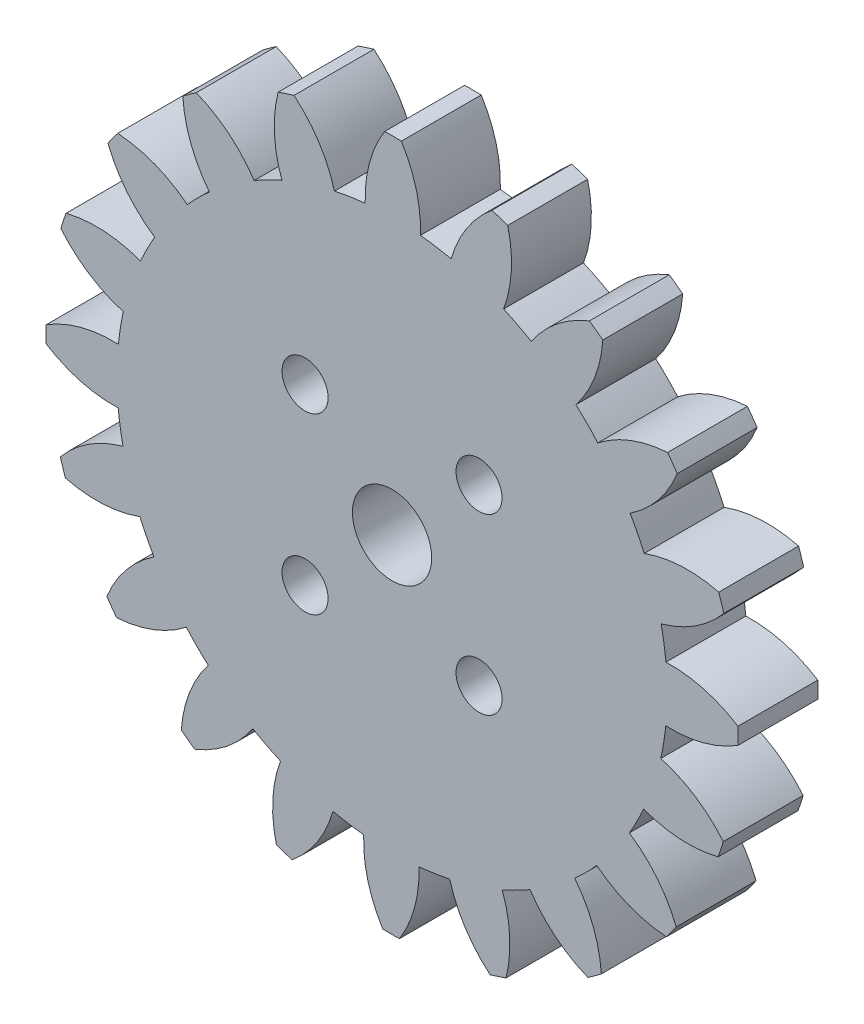
from build123d import *

# Parameters (mm, degrees)
BOSS_EXTRU_1_DEPTH      = 6.35
ENL_V_MAT_EXTRU_1_REACH = 41.406
ESQUISSE2_R             = 3.15
ESQUISSE2_R_2           = 1.83


with BuildPart() as part:
    # Esquisse1 → Boss.-Extru.1 (new body)
    with BuildSketch(Plane.XY):
        with BuildLine():
            ThreePointArc((4.580283008, -21.38908328), (5.809239787, -24.124430095), (7.79392735, -26.37242303))
            ThreePointArc((7.79392735, -26.37242303), (8.426297829, -26.177232568), (9.053788111, -25.96688123))
            ThreePointArc((9.053788111, -25.96688123), (9.354446156, -22.983248931), (8.756985681, -20.044627155))
            ThreePointArc((8.756985681, -20.044627155), (9.877166912, -19.517004119), (10.965698229, -18.926841743))
            ThreePointArc((10.965698229, -18.926841743), (12.979774233, -21.148542625), (15.561992292, -22.673208769))
            ThreePointArc((15.561992292, -22.673208769), (16.103095187, -22.292158383), (16.634871772, -21.898197212))
            ThreePointArc((16.634871772, -21.898197212), (15.998821478, -18.967685826), (14.522518732, -16.357515878))
            ThreePointArc((14.522518732, -16.357515878), (15.424829906, -15.509561514), (16.277714505, -14.611909064))
            ThreePointArc((16.277714505, -14.611909064), (18.879757941, -16.102488453), (21.806741003, -16.75458286))
            ThreePointArc((21.806741003, -16.75458286), (22.203609392, -16.224972418), (22.587618281, -15.685965077))
            ThreePointArc((22.587618281, -15.685965077), (21.077120684, -13.095433477), (18.866486465, -11.069216977))
            ThreePointArc((18.866486465, -11.069216977), (19.462603078, -9.983934966), (19.996354671, -8.86666092))
            ThreePointArc((19.996354671, -8.86666092), (22.9316594, -9.480210518), (25.916893968, -9.195901645))
            ThreePointArc((25.916893968, -9.195901645), (26.130679608, -8.569573106), (26.329331336, -7.93828139))
            ThreePointArc((26.329331336, -7.93828139), (24.092244465, -5.941308858), (21.363671052, -4.697385994))
            ThreePointArc((21.363671052, -4.697385994), (21.595241057, -3.481011302), (21.75761232, -2.253482226))
            ThreePointArc((21.75761232, -2.253482226), (24.738850262, -1.929943525), (27.490120777, -0.737061506))
            ThreePointArc((27.490120777, -0.737061506), (27.499896841, -0.075324271), (27.493745992, 0.586456589))
            ThreePointArc((27.493745992, 0.586456589), (24.749051496, 1.794392467), (21.769630667, 2.134257858))
            ThreePointArc((21.769630667, 2.134257858), (21.613986378, 3.362658002), (21.38908328, 4.580283008))
            ThreePointArc((21.38908328, 4.580283008), (24.124430095, 5.809239787), (26.37242303, 7.79392735))
            ThreePointArc((26.37242303, 7.79392735), (26.177232568, 8.426297829), (25.96688123, 9.053788111))
            ThreePointArc((25.96688123, 9.053788111), (22.983248931, 9.354446156), (20.044627155, 8.756985681))
            ThreePointArc((20.044627155, 8.756985681), (19.517004119, 9.877166912), (18.926841743, 10.965698229))
            ThreePointArc((18.926841743, 10.965698229), (21.148542625, 12.979774233), (22.673208769, 15.561992292))
            ThreePointArc((22.673208769, 15.561992292), (22.292158383, 16.103095187), (21.898197212, 16.634871772))
            ThreePointArc((21.898197212, 16.634871772), (18.967685826, 15.998821478), (16.357515878, 14.522518732))
            ThreePointArc((16.357515878, 14.522518732), (15.509561514, 15.424829906), (14.611909064, 16.277714505))
            ThreePointArc((14.611909064, 16.277714505), (16.102488453, 18.879757941), (16.75458286, 21.806741003))
            ThreePointArc((16.75458286, 21.806741003), (16.224972418, 22.203609392), (15.685965077, 22.587618281))
            ThreePointArc((15.685965077, 22.587618281), (13.095433477, 21.077120684), (11.069216977, 18.866486465))
            ThreePointArc((11.069216977, 18.866486465), (9.983934966, 19.462603078), (8.86666092, 19.996354671))
            ThreePointArc((8.86666092, 19.996354671), (9.480210518, 22.9316594), (9.195901645, 25.916893968))
            ThreePointArc((9.195901645, 25.916893968), (8.569573106, 26.130679608), (7.93828139, 26.329331336))
            ThreePointArc((7.93828139, 26.329331336), (5.941308858, 24.092244465), (4.697385994, 21.363671052))
            ThreePointArc((4.697385994, 21.363671052), (3.481011302, 21.595241057), (2.253482226, 21.75761232))
            ThreePointArc((2.253482226, 21.75761232), (1.929943525, 24.738850262), (0.737061506, 27.490120777))
            ThreePointArc((0.737061506, 27.490120777), (0.075324271, 27.499896841), (-0.586456589, 27.493745992))
            ThreePointArc((-0.586456589, 27.493745992), (-1.794392467, 24.749051496), (-2.134257858, 21.769630667))
            ThreePointArc((-2.134257858, 21.769630667), (-3.362658002, 21.613986378), (-4.580283008, 21.38908328))
            ThreePointArc((-4.580283008, 21.38908328), (-5.809239787, 24.124430095), (-7.79392735, 26.37242303))
            ThreePointArc((-7.79392735, 26.37242303), (-8.426297829, 26.177232568), (-9.053788111, 25.96688123))
            ThreePointArc((-9.053788111, 25.96688123), (-9.354446156, 22.983248931), (-8.756985681, 20.044627155))
            ThreePointArc((-8.756985681, 20.044627155), (-9.877166912, 19.517004119), (-10.965698229, 18.926841743))
            ThreePointArc((-10.965698229, 18.926841743), (-12.979774233, 21.148542625), (-15.561992292, 22.673208769))
            ThreePointArc((-15.561992292, 22.673208769), (-16.103095187, 22.292158383), (-16.634871772, 21.898197212))
            ThreePointArc((-16.634871772, 21.898197212), (-15.998821478, 18.967685826), (-14.522518732, 16.357515878))
            ThreePointArc((-14.522518732, 16.357515878), (-15.424829906, 15.509561514), (-16.277714505, 14.611909064))
            ThreePointArc((-16.277714505, 14.611909064), (-18.879757941, 16.102488453), (-21.806741003, 16.75458286))
            ThreePointArc((-21.806741003, 16.75458286), (-22.203609392, 16.224972418), (-22.587618281, 15.685965077))
            ThreePointArc((-22.587618281, 15.685965077), (-21.077120684, 13.095433477), (-18.866486465, 11.069216977))
            ThreePointArc((-18.866486465, 11.069216977), (-19.462603078, 9.983934966), (-19.996354671, 8.86666092))
            ThreePointArc((-19.996354671, 8.86666092), (-22.9316594, 9.480210518), (-25.916893968, 9.195901645))
            ThreePointArc((-25.916893968, 9.195901645), (-26.130679608, 8.569573106), (-26.329331336, 7.93828139))
            ThreePointArc((-26.329331336, 7.93828139), (-24.092244465, 5.941308858), (-21.363671052, 4.697385994))
            ThreePointArc((-21.363671052, 4.697385994), (-21.595241057, 3.481011302), (-21.75761232, 2.253482226))
            ThreePointArc((-21.75761232, 2.253482226), (-24.738850262, 1.929943525), (-27.490120777, 0.737061506))
            ThreePointArc((-27.490120777, 0.737061506), (-27.499896841, 0.075324271), (-27.493745992, -0.586456589))
            ThreePointArc((-27.493745992, -0.586456589), (-24.749051496, -1.794392467), (-21.769630667, -2.134257858))
            ThreePointArc((-21.769630667, -2.134257858), (-21.613986378, -3.362658002), (-21.38908328, -4.580283008))
            ThreePointArc((-21.38908328, -4.580283008), (-24.124430095, -5.809239787), (-26.37242303, -7.79392735))
            ThreePointArc((-26.37242303, -7.79392735), (-26.177232568, -8.426297829), (-25.96688123, -9.053788111))
            ThreePointArc((-25.96688123, -9.053788111), (-22.983248931, -9.354446156), (-20.044627155, -8.756985681))
            ThreePointArc((-20.044627155, -8.756985681), (-19.517004119, -9.877166912), (-18.926841743, -10.965698229))
            ThreePointArc((-18.926841743, -10.965698229), (-21.148542625, -12.979774233), (-22.673208769, -15.561992292))
            ThreePointArc((-22.673208769, -15.561992292), (-22.292158383, -16.103095187), (-21.898197212, -16.634871772))
            ThreePointArc((-21.898197212, -16.634871772), (-18.967685826, -15.998821478), (-16.357515878, -14.522518732))
            ThreePointArc((-16.357515878, -14.522518732), (-15.509561514, -15.424829906), (-14.611909064, -16.277714505))
            ThreePointArc((-14.611909064, -16.277714505), (-16.102488453, -18.879757941), (-16.75458286, -21.806741003))
            ThreePointArc((-16.75458286, -21.806741003), (-16.224972418, -22.203609392), (-15.685965077, -22.587618281))
            ThreePointArc((-15.685965077, -22.587618281), (-13.095433477, -21.077120684), (-11.069216977, -18.866486465))
            ThreePointArc((-11.069216977, -18.866486465), (-9.983934966, -19.462603078), (-8.86666092, -19.996354671))
            ThreePointArc((-8.86666092, -19.996354671), (-9.480210518, -22.9316594), (-9.195901645, -25.916893968))
            ThreePointArc((-9.195901645, -25.916893968), (-8.569573106, -26.130679608), (-7.93828139, -26.329331336))
            ThreePointArc((-7.93828139, -26.329331336), (-5.941308858, -24.092244465), (-4.697385994, -21.363671052))
            ThreePointArc((-4.697385994, -21.363671052), (-3.481011302, -21.595241057), (-2.253482226, -21.75761232))
            ThreePointArc((-2.253482226, -21.75761232), (-1.929943525, -24.738850262), (-0.737061506, -27.490120777))
            ThreePointArc((-0.737061506, -27.490120777), (-0.075324271, -27.499896841), (0.586456589, -27.493745992))
            ThreePointArc((0.586456589, -27.493745992), (1.794392467, -24.749051496), (2.134257858, -21.769630667))
            ThreePointArc((2.134257858, -21.769630667), (3.362658002, -21.613986378), (4.580283008, -21.38908328))
        make_face()
    extrude(amount=BOSS_EXTRU_1_DEPTH)

    # Esquisse2 → Enlèv. mat.-Extru.1 (cut, up to next)
    with BuildSketch(Plane(origin=(0, 0, 0), x_dir=(-1, 0, 0), z_dir=(0, 0, -1)), mode=Mode.PRIVATE) as enl_v_mat_extru_1_sk1:
        Circle(ESQUISSE2_R)
    enl_v_mat_extru_1_tool1 = extrude(enl_v_mat_extru_1_sk1.sketch, amount=-ENL_V_MAT_EXTRU_1_REACH, mode=Mode.PRIVATE) & part.part
    # Esquisse2 → Enlèv. mat.-Extru.1 (cut, up to next)
    with BuildSketch(Plane(origin=(0, 0, 0), x_dir=(-1, 0, 0), z_dir=(0, 0, -1)), mode=Mode.PRIVATE) as enl_v_mat_extru_1_sk2:
        with Locations((-6.914797213, -6.914797213)):
            Circle(ESQUISSE2_R_2)
    enl_v_mat_extru_1_tool2 = extrude(enl_v_mat_extru_1_sk2.sketch, amount=-ENL_V_MAT_EXTRU_1_REACH, mode=Mode.PRIVATE) & part.part
    # Esquisse2 → Enlèv. mat.-Extru.1 (cut, up to next)
    with BuildSketch(Plane(origin=(0, 0, 0), x_dir=(-1, 0, 0), z_dir=(0, 0, -1)), mode=Mode.PRIVATE) as enl_v_mat_extru_1_sk3:
        with Locations((-6.914797213, 6.914797213)):
            Circle(ESQUISSE2_R_2)
    enl_v_mat_extru_1_tool3 = extrude(enl_v_mat_extru_1_sk3.sketch, amount=-ENL_V_MAT_EXTRU_1_REACH, mode=Mode.PRIVATE) & part.part
    # Esquisse2 → Enlèv. mat.-Extru.1 (cut, up to next)
    with BuildSketch(Plane(origin=(0, 0, 0), x_dir=(-1, 0, 0), z_dir=(0, 0, -1)), mode=Mode.PRIVATE) as enl_v_mat_extru_1_sk4:
        with Locations((6.914797213, 6.914797213)):
            Circle(ESQUISSE2_R_2)
    enl_v_mat_extru_1_tool4 = extrude(enl_v_mat_extru_1_sk4.sketch, amount=-ENL_V_MAT_EXTRU_1_REACH, mode=Mode.PRIVATE) & part.part
    # Esquisse2 → Enlèv. mat.-Extru.1 (cut, up to next)
    with BuildSketch(Plane(origin=(0, 0, 0), x_dir=(-1, 0, 0), z_dir=(0, 0, -1)), mode=Mode.PRIVATE) as enl_v_mat_extru_1_sk5:
        with Locations((6.914797213, -6.914797213)):
            Circle(ESQUISSE2_R_2)
    enl_v_mat_extru_1_tool5 = extrude(enl_v_mat_extru_1_sk5.sketch, amount=-ENL_V_MAT_EXTRU_1_REACH, mode=Mode.PRIVATE) & part.part
    add(enl_v_mat_extru_1_tool1.solids().sort_by_distance((0, 0, 0))[0], mode=Mode.SUBTRACT)
    add(enl_v_mat_extru_1_tool2.solids().sort_by_distance((6.914797, -6.914797, 0))[0], mode=Mode.SUBTRACT)
    add(enl_v_mat_extru_1_tool3.solids().sort_by_distance((6.914797, 6.914797, 0))[0], mode=Mode.SUBTRACT)
    add(enl_v_mat_extru_1_tool4.solids().sort_by_distance((-6.914797, 6.914797, 0))[0], mode=Mode.SUBTRACT)
    add(enl_v_mat_extru_1_tool5.solids().sort_by_distance((-6.914797, -6.914797, 0))[0], mode=Mode.SUBTRACT)


solid = part.part
